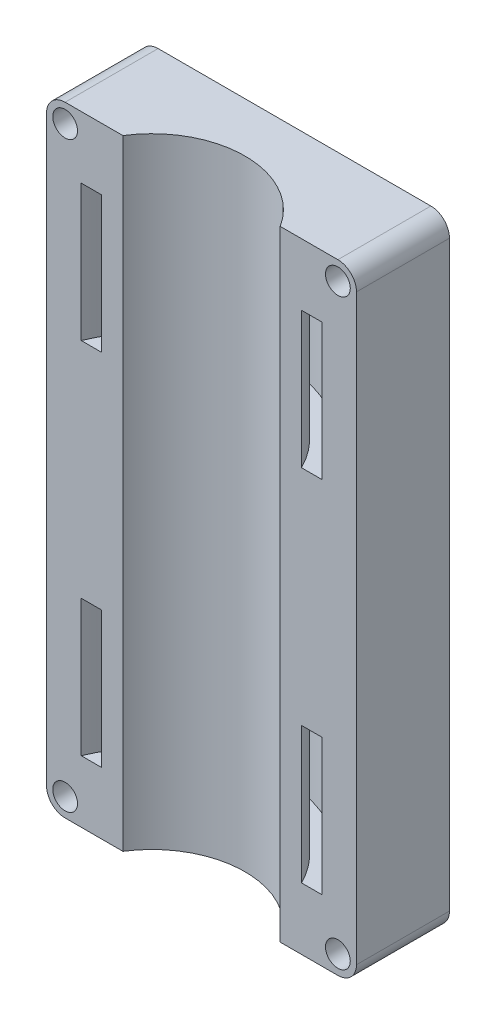
from build123d import *

# Parameters (mm, degrees)
SKETCH1_R           = 2
BOSS_EXTRUDE1_DEPTH = 15
CUT_EXTRUDE1_DEPTH  = 105.165020701
CUT_EXTRUDE2_START  = -10
CUT_EXTRUDE2_DEPTH  = 22
CUT_EXTRUDE3_START  = -68
CUT_EXTRUDE3_DEPTH  = 22


with BuildPart() as part:
    # Sketch1 → Boss-Extrude1 (new body)
    with BuildSketch(Plane.XY):
        with BuildLine():
            Line((-22.007029764, -50.000223574), (21.992970236, -50.000223574))
            ThreePointArc((21.992970236, -50.000223574), (24.114290579, -49.121543918), (24.992970236, -47.000223574))
            Line((24.992970236, -47.000223574), (24.992970236, 46.999776426))
            ThreePointArc((24.992970236, 46.999776426), (24.114290579, 49.12109677), (21.992970236, 49.999776426))
            Line((21.992970236, 49.999776426), (-22.007029764, 49.999776426))
            ThreePointArc((-22.007029764, 49.999776426), (-24.128350108, 49.12109677), (-25.007029764, 46.999776426))
            Line((-25.007029764, 46.999776426), (-25.007029764, -47.000223574))
            ThreePointArc((-25.007029764, -47.000223574), (-24.128350108, -49.121543918), (-22.007029764, -50.000223574))
        make_face()
        with Locations((-22.007029764, -47.000223574)):
            Circle(SKETCH1_R, mode=Mode.SUBTRACT)
        with Locations((21.992970236, -47.000223574)):
            Circle(SKETCH1_R, mode=Mode.SUBTRACT)
        with Locations((-22.007029764, 46.999776426)):
            Circle(SKETCH1_R, mode=Mode.SUBTRACT)
        with Locations((21.992970236, 46.999776426)):
            Circle(SKETCH1_R, mode=Mode.SUBTRACT)
    extrude(amount=BOSS_EXTRUDE1_DEPTH)

    # Sketch2 → Cut-Extrude1 (cut, through all)
    with BuildSketch(Plane(origin=(0, 49.999776426, 0), x_dir=(1, 0, 0), z_dir=(0, 1, 0))):
        with BuildLine():
            ThreePointArc((12.68857754, -15), (0, -8), (-12.68857754, -15))
            Line((-12.68857754, -15), (12.68857754, -15))
        make_face()
    extrude(amount=-CUT_EXTRUDE1_DEPTH, mode=Mode.SUBTRACT)

    # Sketch2<4> → Cut-Extrude2 (cut)
    with BuildSketch(Plane(origin=(0, 49.999776426, 0), x_dir=(1, 0, 0), z_dir=(0, 1, 0)).offset(CUT_EXTRUDE2_START)):
        with BuildLine():
            ThreePointArc((19.416487839, -15), (0, -2), (-19.416487839, -15))
            Line((-19.416487839, -15), (-16.124515497, -15))
            ThreePointArc((-16.124515497, -15), (0, -5), (16.124515497, -15))
            Line((16.124515497, -15), (19.416487839, -15))
        make_face()
    extrude(amount=-CUT_EXTRUDE2_DEPTH, mode=Mode.SUBTRACT)

    # Sketch2<5> → Cut-Extrude3 (cut)
    with BuildSketch(Plane(origin=(0, 49.999776426, 0), x_dir=(1, 0, 0), z_dir=(0, 1, 0)).offset(CUT_EXTRUDE3_START)):
        with BuildLine():
            ThreePointArc((19.416487839, -15), (0, -2), (-19.416487839, -15))
            Line((-19.416487839, -15), (-16.124515497, -15))
            ThreePointArc((-16.124515497, -15), (0, -5), (16.124515497, -15))
            Line((16.124515497, -15), (19.416487839, -15))
        make_face()
    extrude(amount=-CUT_EXTRUDE3_DEPTH, mode=Mode.SUBTRACT)


solid = part.part
